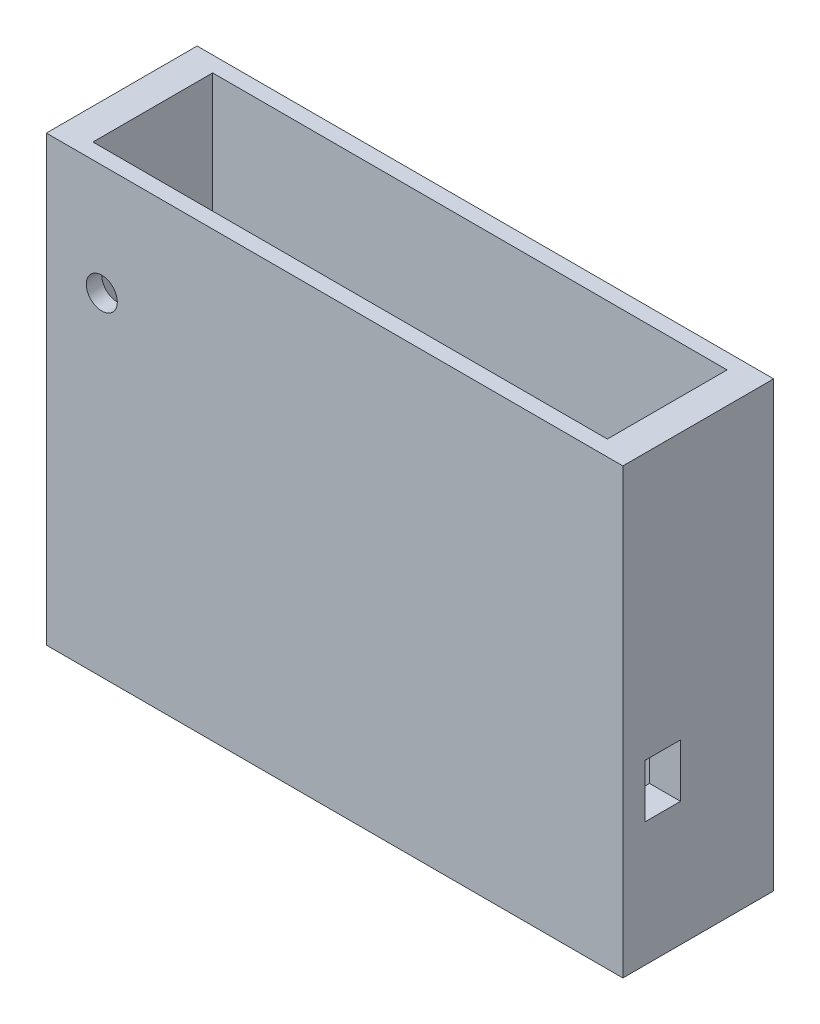
from build123d import *

# Parameters (mm, degrees)
ESQUISSE1_W             = 130
ESQUISSE1_H             = 100
BOSS_EXTRU_1_DEPTH      = 34
ESQUISSE2_W             = 116
ESQUISSE2_H             = 27
ENL_V_MAT_EXTRU_1_DEPTH = 106
ESQUISSE3_R             = 3.5
ENL_V_MAT_EXTRU_2_DEPTH = 10
ESQUISSE4_W             = 8
ESQUISSE4_H             = 12
ENL_V_MAT_EXTRU_3_DEPTH = 10


with BuildPart() as part:
    # Esquisse1 → Boss.-Extru.1 (new body)
    with BuildSketch(Plane.XY):
        with Locations((-0.177352831, 10.760428886)):
            Rectangle(ESQUISSE1_W, ESQUISSE1_H)
    extrude(amount=BOSS_EXTRU_1_DEPTH)

    # Esquisse2 → Enlèv. mat.-Extru.1 (cut)
    with BuildSketch(Plane.XZ.offset(39.239571114)):
        with Locations((-0.177352831, 17)):
            Rectangle(ESQUISSE2_W, ESQUISSE2_H)
    extrude(amount=-ENL_V_MAT_EXTRU_1_DEPTH, mode=Mode.SUBTRACT)

    # Esquisse3 → Enlèv. mat.-Extru.2 (cut)
    with BuildSketch(Plane.XY.offset(34)):
        with Locations((-52.677352831, 35.760428886)):
            Circle(ESQUISSE3_R)
    extrude(amount=-ENL_V_MAT_EXTRU_2_DEPTH, mode=Mode.SUBTRACT)

    # Esquisse4 → Enlèv. mat.-Extru.3 (cut)
    with BuildSketch(Plane(origin=(64.822647169, 0, 0), x_dir=(0, 0, -1), z_dir=(1, 0, 0))):
        with Locations((-25, -5.239571114)):
            Rectangle(ESQUISSE4_W, ESQUISSE4_H)
    extrude(amount=-ENL_V_MAT_EXTRU_3_DEPTH, mode=Mode.SUBTRACT)


solid = part.part
